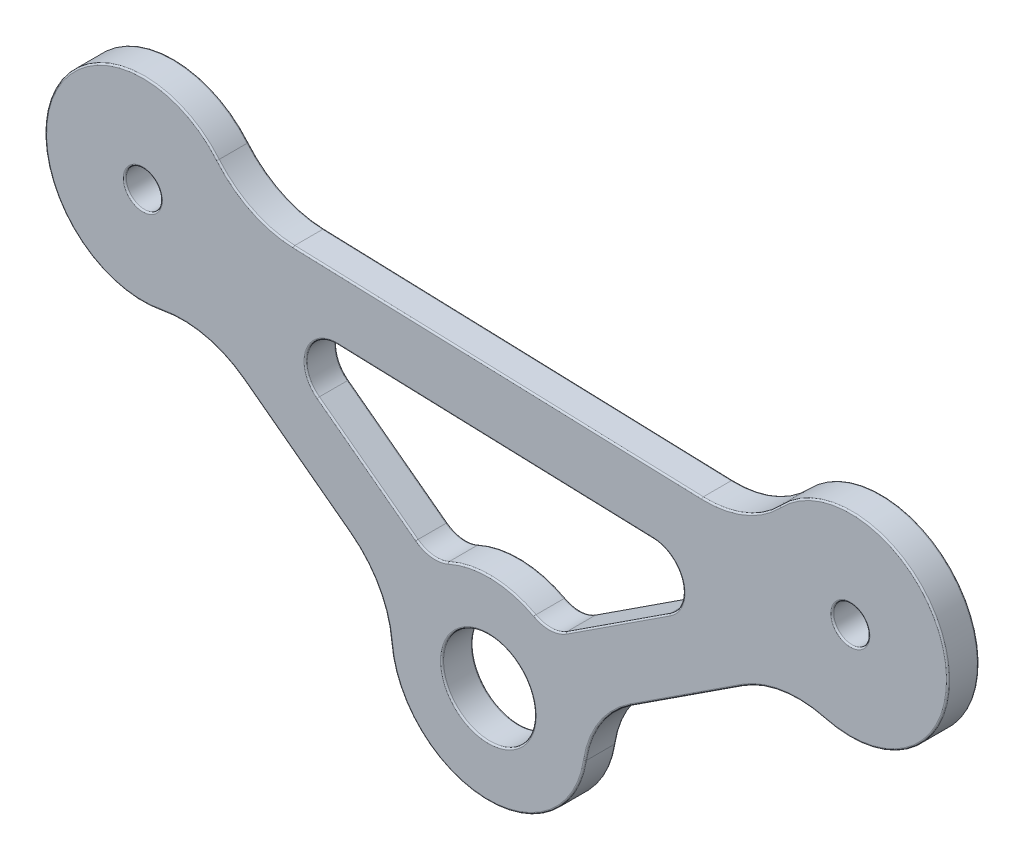
from build123d import *

# Parameters (mm, degrees)
SKETCH1_R             = 9.5
SKETCH1_R_2           = 4.5
BOSS_EXTRUDE1_DEPTH   = 3
SKETCH1_R_3           = 1.75
BOSS_EXTRUDE1_2_DEPTH = 3
BOSS_EXTRUDE1_3_DEPTH = 3
EXTRUDE_THIN1_DEPTH   = 3
FILLET1_R             = 3
FILLET2_R             = 10
FILLET3_R             = 0.15


with BuildPart() as part:
    # Sketch1 → Boss-Extrude1 (new body)
    with BuildSketch(Plane.XY):
        with Locations((16.938125623, 131.647989579)):
            Circle(SKETCH1_R)
        with Locations((16.938125623, 131.647989579)):
            Circle(SKETCH1_R_2, mode=Mode.SUBTRACT)
    extrude(amount=BOSS_EXTRUDE1_DEPTH)



with BuildPart() as body_2:
    # Sketch1 → Boss-Extrude1 2 (new body)
    with BuildSketch(Plane.XY):
        with Locations((52.111714386, 154.596224799)):
            Circle(SKETCH1_R)
        with Locations((52.111714386, 154.596224799)):
            Circle(SKETCH1_R_3, mode=Mode.SUBTRACT)
    extrude(amount=BOSS_EXTRUDE1_2_DEPTH)


with BuildPart() as body_3:
    # Sketch1 → Boss-Extrude1 3 (new body)
    with BuildSketch(Plane.XY):
        with Locations((-16.644123116, 156.850203209)):
            Circle(SKETCH1_R)
        with Locations((-16.644123116, 156.850203209)):
            Circle(SKETCH1_R_3, mode=Mode.SUBTRACT)
    extrude(amount=BOSS_EXTRUDE1_3_DEPTH)


with BuildPart() as part_1:
    add(part.part)

    add(body_2.part)  # Extrude-Thin1 merges body 2

    add(body_3.part)  # Extrude-Thin1 merges body 3
    # Sketch2 → Extrude-Thin1 (add)
    with BuildSketch(Plane.XY.offset(3)):
        Polygon((45.317324912, 157.820572492), (-9.653145107, 159.622634064), (-9.849733642, 153.625855517), (45.120736377, 151.823793944), align=None)
        Polygon((13.945048076, 137.645014029), (-10.049625673, 155.652113509), (-13.651045569, 150.853178759), (10.34362818, 132.84607928), align=None)
        Polygon((23.601473229, 132.413311247), (48.726869314, 148.805823914), (45.448366781, 153.830903131), (20.322970695, 137.438390464), align=None)
    extrude(amount=-EXTRUDE_THIN1_DEPTH)

    # Fillet1
    fillet1_edges = [part_1.edges().sort_by_distance(p)[0] for p in [
        (11.52933336, 139.457916996, 1.5),
        (-7.235411743, 153.540151883, 1.5),
        (22.848116349, 139.085866268, 1.5),
        (42.503505286, 151.909592948, 1.5),
    ]]
    fillet(fillet1_edges, radius=FILLET1_R)

    # Fillet2
    fillet2_edges = [part_1.edges().sort_by_distance(p)[0] for p in [
        (7.927913464, 134.658982246, 1.5),
        (-11.235330852, 149.040275793, 1.5),
        (-7.53679029, 159.553254965, 1.5),
        (43.200970095, 157.889951591, 1.5),
        (46.201723661, 147.15834811, 1.5),
        (26.126618882, 134.060787051, 1.5),
    ]]
    fillet(fillet2_edges, radius=FILLET2_R)

    # Fillet3
    fillet3_edges = [part_1.edges().sort_by_distance(p)[0] for p in [
        (29.508735537, 143.431440922, 3),
        (29.508735537, 143.431440922, 0),
        (17.250224022, 141.142861595, 0),
        (17.250224022, 141.142861595, 3),
        (5.170343636, 144.230099429, 0),
        (5.170343636, 144.230099429, 3),
        (17.632592176, 152.7249201, 3),
        (17.632592176, 152.7249201, 0),
        (22.972660764, 139.667774248, 3),
        (22.972660764, 139.667774248, 0),
        (11.443271365, 140.046747653, 3),
        (11.443271365, 140.046747653, 0),
        (35.78447434, 150.030828409, 0),
        (35.78447434, 150.030828409, 3),
        (-0.656677204, 151.225706459, 3),
        (-0.656677204, 151.225706459, 0),
        (17.832089903, 158.721603278, 3),
        (17.832089903, 158.721603278, 0),
        (61.260778541, 157.154471284, 3),
        (61.260778541, 157.154471284, 0),
        (36.164171271, 140.609567581, 0),
        (36.164171271, 140.609567581, 3),
        (16.626027225, 122.153117564, 0),
        (16.626027225, 122.153117564, 3),
        (-1.653708694, 141.84962902, 0),
        (-1.653708694, 141.84962902, 3),
        (-25.605716427, 160.002955234, 3),
        (-25.605716427, 160.002955234, 0),
        (41.79220908, 158.80789286, 0),
        (41.79220908, 158.80789286, 3),
        (45.473400169, 145.642838736, 0),
        (45.473400169, 145.642838736, 3),
        (27.807118638, 134.116861482, 3),
        (27.807118638, 134.116861482, 0),
        (6.254723559, 134.825293147, 3),
        (6.254723559, 134.825293147, 0),
        (-10.608102178, 147.48020914, 3),
        (-10.608102178, 147.48020914, 0),
        (-6.07093402, 160.376959505, 0),
        (-6.07093402, 160.376959505, 3),
        (-18.394123116, 156.850203209, 0),
        (-18.394123116, 156.850203209, 3),
        (12.438125623, 131.647989579, 0),
        (12.438125623, 131.647989579, 3),
        (50.361714386, 154.596224799, 0),
        (50.361714386, 154.596224799, 3),
    ]]
    fillet(fillet3_edges, radius=FILLET3_R)


solid = part_1.part
